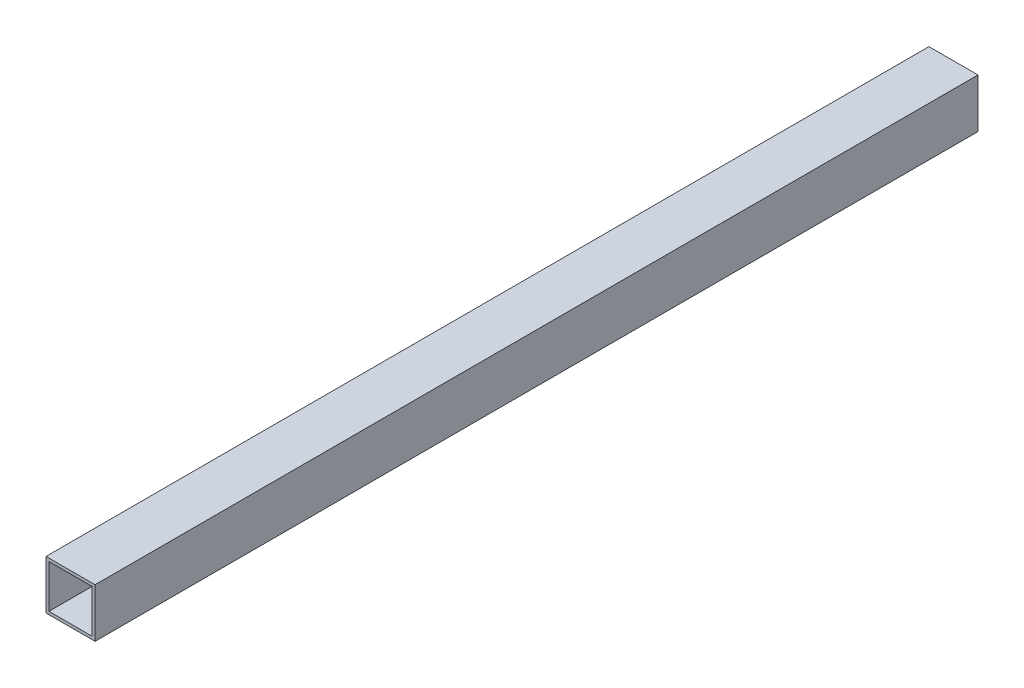
from build123d import *

# Parameters (mm, degrees)
CROQUIS1_W              = 50
CROQUIS1_H              = 50
CROQUIS1_W_2            = 44
CROQUIS1_H_2            = 44
SALIENTE_EXTRUIR1_DEPTH = 450


with BuildPart() as part:
    # Croquis1 → Saliente-Extruir1 (new, symmetric)
    with BuildSketch(Plane.XY):
        Rectangle(CROQUIS1_W, CROQUIS1_H)
        Rectangle(CROQUIS1_W_2, CROQUIS1_H_2, mode=Mode.SUBTRACT)
    extrude(amount=SALIENTE_EXTRUIR1_DEPTH, both=True)


solid = part.part
